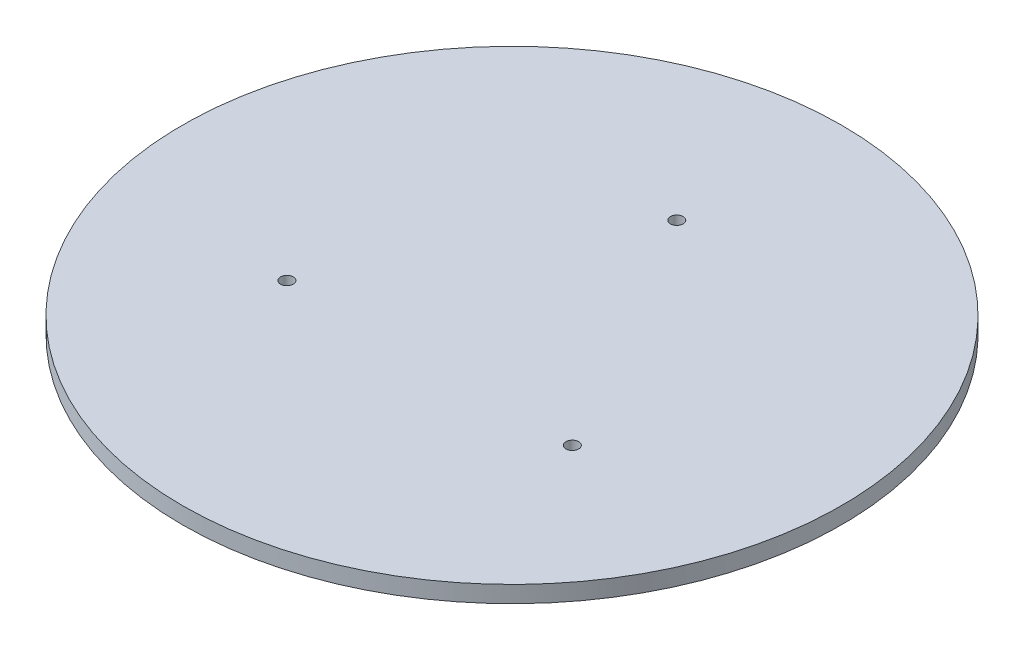
from build123d import *

# Parameters (mm, degrees)
SKETCH1_R           = 125.38075
SKETCH1_R_2         = 2.4257
BOSS_EXTRUDE1_DEPTH = 6.35


with BuildPart() as part:
    # Sketch1 → Boss-Extrude1 (new body)
    with BuildSketch(Plane(origin=(0, 0, 0), x_dir=(1, 0, 0), z_dir=(0, 1, 0))):
        with Locations(Location((0, 0, 0), (0, 0, 270))):
            Circle(SKETCH1_R)
        with Locations(Location((0, 62.690375, 0), (0, 0, 270))):
            Circle(SKETCH1_R_2, mode=Mode.SUBTRACT)
        with Locations(Location((54.291457323, -31.3451875, 0), (0, 0, 270))):
            Circle(SKETCH1_R_2, mode=Mode.SUBTRACT)
        with Locations(Location((-54.291457323, -31.3451875, 0), (0, 0, 270))):
            Circle(SKETCH1_R_2, mode=Mode.SUBTRACT)
    extrude(amount=BOSS_EXTRUDE1_DEPTH)


solid = part.part
